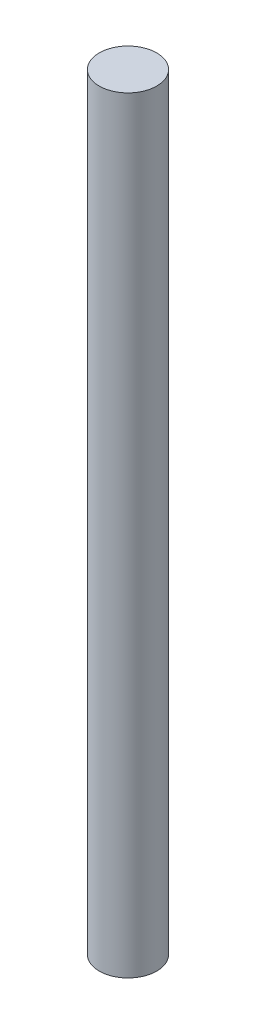
from build123d import *

# Parameters (mm, degrees)
SKETCH3_R           = 9.525
BOSS_EXTRUDE1_DEPTH = 254


with BuildPart() as part:
    # Sketch3 → Boss-Extrude1 (new body)
    with BuildSketch(Plane(origin=(0, 0, 0), x_dir=(1, 0, 0), z_dir=(0, 1, 0))):
        with Locations(Location((0, 0, 0), (0, 0, 270))):
            Circle(SKETCH3_R)
    extrude(amount=BOSS_EXTRUDE1_DEPTH)


solid = part.part
